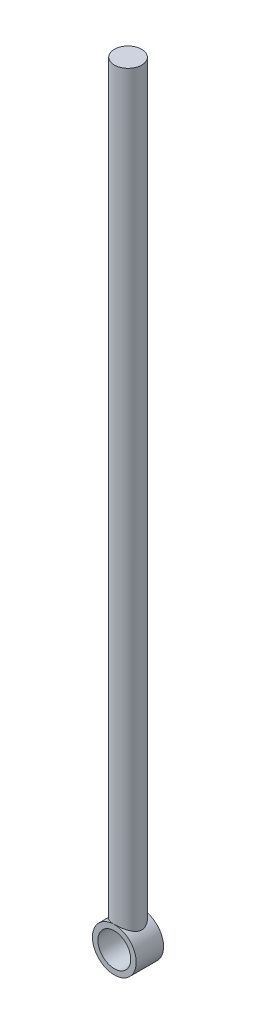
from build123d import *

# Parameters (mm, degrees)
SKETCH_1_R          = 4
EXTRUDE_1_DEPTH     = 5
SKETCH_3_R          = 2.5
EXTRUDE_2_DEPTH     = 140
SKETCH_2_R          = 3
CUT_EXTRUDE_1_DEPTH = 5


with BuildPart() as part:
    # 草图1 → 凸台-拉伸1 (new body)
    with BuildSketch(Plane.XY):
        Circle(SKETCH_1_R)
    extrude(amount=EXTRUDE_1_DEPTH)

    # 草图3 → 凸台-拉伸2 (add)
    with BuildSketch(Plane(origin=(0, 0, 0), x_dir=(1, 0, 0), z_dir=(0, 1, 0))):
        with Locations(Location((0, -2.490986951, 0), (0, 0, 85.133305815))):
            Circle(SKETCH_3_R)
    extrude(amount=EXTRUDE_2_DEPTH)

    # 草图2 → 切除-拉伸1 (cut)
    with BuildSketch(Plane.XY.offset(5)):
        Circle(SKETCH_2_R)
    extrude(amount=-CUT_EXTRUDE_1_DEPTH, mode=Mode.SUBTRACT)


solid = part.part
